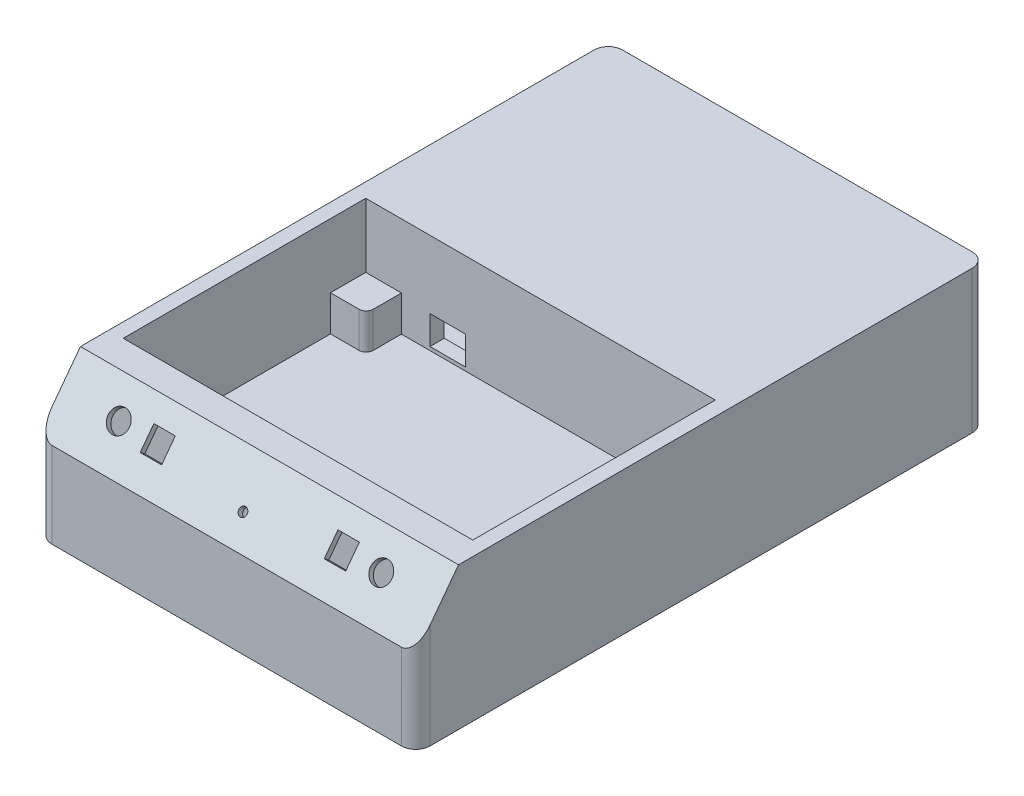
from build123d import *

# Parameters (mm, degrees)
BOSS_EXTRUDE2_DEPTH      = 100
SKETCH4_W                = 245
SKETCH4_H                = 170
CUT_EXTRUDE2_DEPTH       = 70
CUT_EXTRUDE12_DEPTH      = 434.077648927
CUT_EXTRUDE12_DEPTH_BACK = 434.077648927
CUT_EXTRUDE13_DEPTH      = 122.5
CUT_EXTRUDE14_DEPTH      = 122.5
SKETCH16_R               = 2.5
SKETCH16_R_2             = 2.25
SKETCH16_W               = 28.5
SKETCH16_H               = 48
CUT_EXTRUDE15_DEPTH      = 30
SKETCH17_R               = 2.952889484
SKETCH17_R_2             = 7.5
SKETCH17_W               = 15
SKETCH17_H               = 16
CUT_EXTRUDE16_DEPTH      = 10
BOSS_EXTRUDE3_DEPTH      = 25
SKETCH19_W               = 25
SKETCH19_H               = 20
CUT_EXTRUDE17_DEPTH      = 15
SKETCH21_W               = 195.080232819
SKETCH21_H               = 190
BOSS_EXTRUDE9_DEPTH      = 10


with BuildPart() as part:
    # Sketch1 → Boss-Extrude2 (new body)
    with BuildSketch(Plane(origin=(0, 0, 0), x_dir=(1, 0, 0), z_dir=(0, 1, 0))):
        with BuildLine():
            Line((0, -10), (0, -390))
            ThreePointArc((0, -390), (2.928932188, -397.071067812), (10, -400))
            Line((10, -400), (255, -400))
            ThreePointArc((255, -400), (262.071067812, -397.071067812), (265, -390))
            Line((265, -390), (265, -10))
            ThreePointArc((265, -10), (262.071067812, -2.928932188), (255, 0))
            Line((255, 0), (10, 0))
            ThreePointArc((10, 0), (2.928932188, -2.928932188), (0, -10))
        make_face()
    extrude(amount=BOSS_EXTRUDE2_DEPTH)

    # Sketch4 → Cut-Extrude2 (cut)
    with BuildSketch(Plane(origin=(0, 100, 0), x_dir=(1, 0, 0), z_dir=(0, 1, 0))):
        with Locations((132.5, -265)):
            Rectangle(SKETCH4_W, SKETCH4_H)
    extrude(amount=-CUT_EXTRUDE2_DEPTH, mode=Mode.SUBTRACT)

    # Sketch10 → Cut-Extrude12 (cut, two sides: drawn at the far end of the back side and taken through both)
    with BuildSketch(Plane(origin=(132.5, 0, 0), x_dir=(0, 0, -1), z_dir=(1, 0, 0)).offset(-CUT_EXTRUDE12_DEPTH_BACK)):
        Polygon((-400, 60), (-370, 100), (-400, 100), align=None)
    extrude(amount=CUT_EXTRUDE12_DEPTH + CUT_EXTRUDE12_DEPTH_BACK, mode=Mode.SUBTRACT)

    # Sketch14 → Cut-Extrude13 (cut, symmetric)
    with BuildSketch(Plane(origin=(132.5, 0, 0), x_dir=(0, 0, -1), z_dir=(1, 0, 0))):
        Polygon((-390, 10), (-360, 10), (-360, 96), (-368, 96), (-390, 66.666666667), align=None)
    extrude(amount=CUT_EXTRUDE13_DEPTH, both=True, mode=Mode.SUBTRACT)

    # Sketch15 → Cut-Extrude14 (cut, symmetric)
    with BuildSketch(Plane(origin=(132.5, 0, 0), x_dir=(0, 0, -1), z_dir=(1, 0, 0))):
        Polygon((-360, 9.784104138), (-360, 20), (-170, 20), (-170, 95), (-5, 95), (-5, 10), align=None)
    extrude(amount=CUT_EXTRUDE14_DEPTH, both=True, mode=Mode.SUBTRACT)

    # Sketch16 → Cut-Extrude15 (cut)
    with BuildSketch(Plane(origin=(0, 0, 0), x_dir=(-1, 0, 0), z_dir=(0, 0, -1))):
        with Locations((-99.351479045, 82.346777086)):
            Circle(SKETCH16_R)
        with Locations((-32.789304606, 14.265780679)):
            Circle(SKETCH16_R)
        with Locations((-33.351479045, 80.263386392)):
            Circle(SKETCH16_R)
        with Locations((-98.789304606, 16.349171373)):
            Circle(SKETCH16_R)
        with Locations((-241, 44.598834986)):
            Circle(SKETCH16_R_2)
        with Locations((-201, 44.598834986)):
            Circle(SKETCH16_R_2)
        with BuildLine():
            Line((-98.891846609, 75.787809753), (-33.891846609, 75.787809753))
            ThreePointArc((-33.891846609, 75.787809753), (-31.391846609, 73.287809753), (-33.891846609, 70.787809753))
            Line((-33.891846609, 70.787809753), (-98.891846609, 70.787809753))
            ThreePointArc((-98.891846609, 70.787809753), (-101.391846609, 73.287809753), (-98.891846609, 75.787809753))
        make_face()
        with BuildLine():
            Line((-98.710582977, 67.787809753), (-33.710582977, 67.787809753))
            ThreePointArc((-33.710582977, 67.787809753), (-31.292813717, 65.370040492), (-33.710582977, 62.952271231))
            Line((-33.710582977, 62.952271231), (-98.710582977, 62.952271231))
            ThreePointArc((-98.710582977, 62.952271231), (-101.128352238, 65.370040492), (-98.710582977, 67.787809753))
        make_face()
        with BuildLine():
            Line((-98.976192668, 59.952271231), (-33.976192668, 59.952271231))
            ThreePointArc((-33.976192668, 59.952271231), (-31.476192668, 57.452271231), (-33.976192668, 54.952271231))
            Line((-33.976192668, 54.952271231), (-98.976192668, 54.952271231))
            ThreePointArc((-98.976192668, 54.952271231), (-101.476192668, 57.452271231), (-98.976192668, 59.952271231))
        make_face()
        with BuildLine():
            Line((-98.733660424, 52.195845601), (-33.733660424, 52.195845601))
            ThreePointArc((-33.733660424, 52.195845601), (-31.233660424, 49.695845601), (-33.733660424, 47.195845601))
            Line((-33.733660424, 47.195845601), (-98.733660424, 47.195845601))
            ThreePointArc((-98.733660424, 47.195845601), (-101.233660424, 49.695845601), (-98.733660424, 52.195845601))
        make_face()
        with BuildLine():
            Line((-98.864643365, 44.598834986), (-33.864643365, 44.598834986))
            ThreePointArc((-33.864643365, 44.598834986), (-31.364643365, 42.098834986), (-33.864643365, 39.598834986))
            Line((-33.864643365, 39.598834986), (-98.864643365, 39.598834986))
            ThreePointArc((-98.864643365, 39.598834986), (-101.364643365, 42.098834986), (-98.864643365, 44.598834986))
        make_face()
        with BuildLine():
            Line((-98.864643365, 37.00182437), (-33.864643365, 37.00182437))
            ThreePointArc((-33.864643365, 37.00182437), (-31.364643365, 34.50182437), (-33.864643365, 32.00182437))
            Line((-33.864643365, 32.00182437), (-98.864643365, 32.00182437))
            ThreePointArc((-98.864643365, 32.00182437), (-101.364643365, 34.50182437), (-98.864643365, 37.00182437))
        make_face()
        with BuildLine():
            Line((-98.340711599, 28.618916104), (-33.340711599, 28.618916104))
            ThreePointArc((-33.340711599, 28.618916104), (-30.840711599, 26.118916104), (-33.340711599, 23.618916104))
            Line((-33.340711599, 23.618916104), (-98.340711599, 23.618916104))
            ThreePointArc((-98.340711599, 23.618916104), (-100.840711599, 26.118916104), (-98.340711599, 28.618916104))
        make_face()
        with Locations((-220.75, 44)):
            Rectangle(SKETCH16_W, SKETCH16_H)
    extrude(amount=-CUT_EXTRUDE15_DEPTH, mode=Mode.SUBTRACT)

    # Sketch17 → Cut-Extrude16 (cut)
    with BuildSketch(Plane(origin=(0, 213.6, 284.8), x_dir=(1, 0, 0), z_dir=(0, 0.5999999999999998, 0.8000000000000004))):
        with Locations(Location((132.5, -173, 0), (0, 0, 270))):
            Circle(SKETCH17_R)
        with Locations(Location((40.5, -164.727732251, 0), (0, 0, 270))):
            Circle(SKETCH17_R_2)
        with Locations(Location((224.5, -164.727732251, 0), (0, 0, 270))):
            Circle(SKETCH17_R_2)
        with Locations((68, -165)):
            Rectangle(SKETCH17_W, SKETCH17_H)
        with Locations((197, -165)):
            Rectangle(SKETCH17_W, SKETCH17_H)
    extrude(amount=-CUT_EXTRUDE16_DEPTH, mode=Mode.SUBTRACT)

    # Sketch18 → Boss-Extrude3 (add)
    with BuildSketch(Plane(origin=(0, 30, 0), x_dir=(1, 0, 0), z_dir=(0, 1, 0))):
        with BuildLine():
            Line((10, -180), (10, -204.729927007))
            Line((10, -204.729927007), (30, -204.729927007))
            ThreePointArc((30, -204.729927007), (33.43872324, -203.359690427), (34.99270073, -200))
            Line((34.99270073, -200), (34.99270073, -180))
            Line((34.99270073, -180), (10, -180))
        make_face()
        with BuildLine():
            Line((255, -350), (255, -324.14910859))
            Line((255, -324.14910859), (235, -324.14910859))
            ThreePointArc((235, -324.14910859), (231.175444009, -325.928429861), (230.072933549, -330))
            Line((230.072933549, -330), (230.072933549, -350))
            Line((230.072933549, -350), (255, -350))
        make_face()
    extrude(amount=BOSS_EXTRUDE3_DEPTH)

    # Sketch19 → Cut-Extrude17 (cut)
    with BuildSketch(Plane.XY.offset(180)):
        with Locations((67.49270073, 42.5)):
            Rectangle(SKETCH19_W, SKETCH19_H)
    extrude(amount=-CUT_EXTRUDE17_DEPTH, mode=Mode.SUBTRACT)


with BuildPart() as body_2:
    # Sketch21 → Boss-Extrude9 (new body)
    with BuildSketch(Plane.XZ.offset(-20)):
        with Locations((132.53281714, 265)):
            Rectangle(SKETCH21_W, SKETCH21_H)
    extrude(amount=BOSS_EXTRUDE9_DEPTH)


solid = Compound([part.part, body_2.part])
